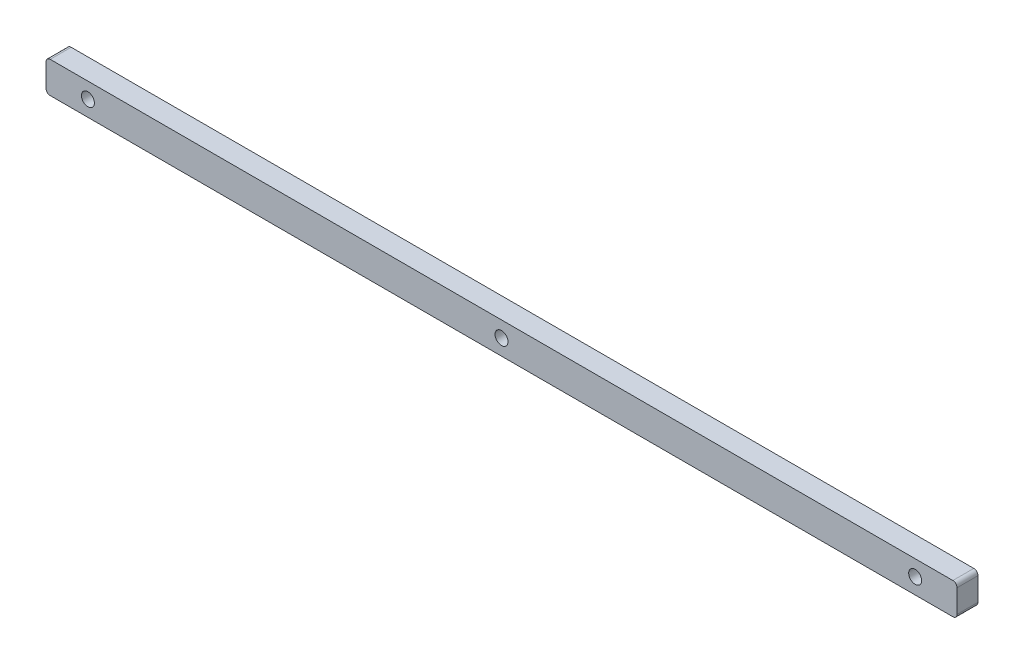
from build123d import *

# Parameters (mm, degrees)
SKETCH1_W           = 552.45
SKETCH1_H           = 19.05
SKETCH1_R           = 3.937
BOSS_EXTRUDE1_DEPTH = 6.35
FILLET1_R           = 2.54


with BuildPart() as part:
    # Sketch1 → Boss-Extrude1 (new, symmetric)
    with BuildSketch(Plane.XY):
        Rectangle(SKETCH1_W, SKETCH1_H)
        Circle(SKETCH1_R, mode=Mode.SUBTRACT)
        with Locations((-250.825, 0)):
            Circle(SKETCH1_R, mode=Mode.SUBTRACT)
        with Locations((250.825, 0)):
            Circle(SKETCH1_R, mode=Mode.SUBTRACT)
    extrude(amount=BOSS_EXTRUDE1_DEPTH, both=True)

    # Fillet1
    fillet1_edges = [part.edges().sort_by_distance(p)[0] for p in [
        (276.225, -9.525, 0),
        (-276.225, -9.525, 0),
        (-276.225, 9.525, 0),
        (276.225, 9.525, 0),
    ]]
    fillet(fillet1_edges, radius=FILLET1_R)


solid = part.part
